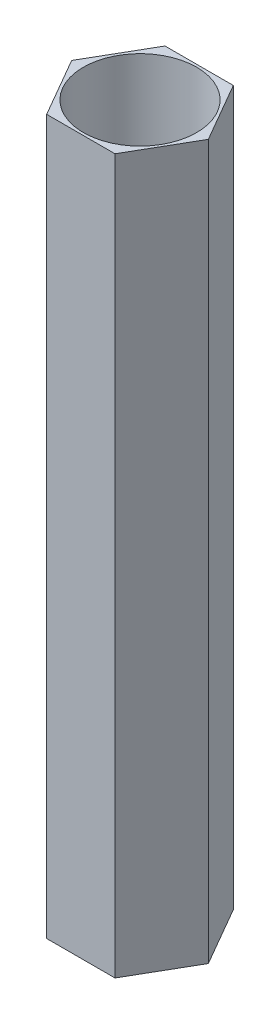
from build123d import *

# Parameters (mm, degrees)
SKETCH1_R           = 2.25
BOSS_EXTRUDE1_DEPTH = 28.35


with BuildPart() as part:
    # Sketch1 → Boss-Extrude1 (new body)
    with BuildSketch(Plane(origin=(0, 0, 0), x_dir=(1, 0, 0), z_dir=(0, 1, 0))):
        Polygon((1.356773133, -2.35), (2.713546265, 0), (1.356773133, 2.35), (-1.356773133, 2.35), (-2.713546265, 0), (-1.356773133, -2.35), align=None)
        with Locations(Location((0, 0, 0), (0, 0, 90))):
            Circle(SKETCH1_R, mode=Mode.SUBTRACT)
    extrude(amount=BOSS_EXTRUDE1_DEPTH)


solid = part.part
